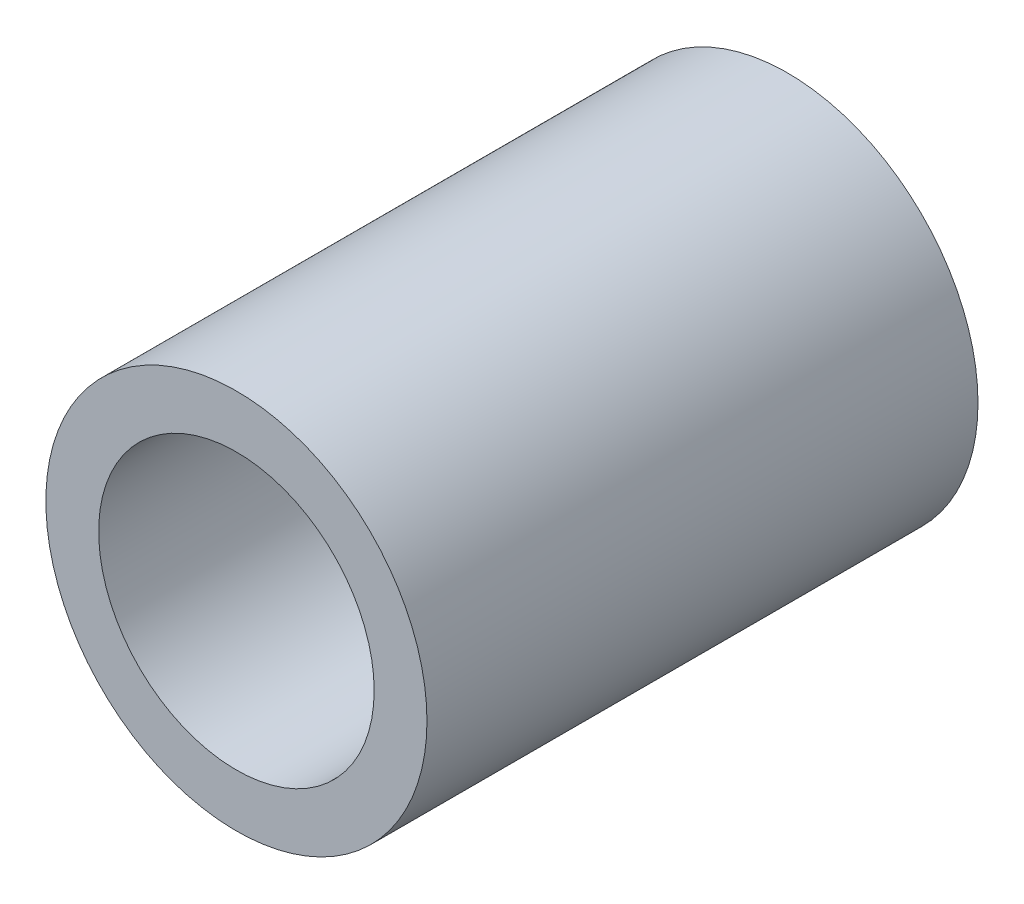
from build123d import *

# Parameters (mm, degrees)
ESQUISSE1_R      = 41.5
ESQUISSE1_R_2    = 30
EXTRUSION1_DEPTH = 120


with BuildPart() as part:
    # Esquisse1 → Extrusion1 (new body)
    with BuildSketch(Plane.XY):
        Circle(ESQUISSE1_R)
        Circle(ESQUISSE1_R_2, mode=Mode.SUBTRACT)
    extrude(amount=EXTRUSION1_DEPTH)


solid = part.part
